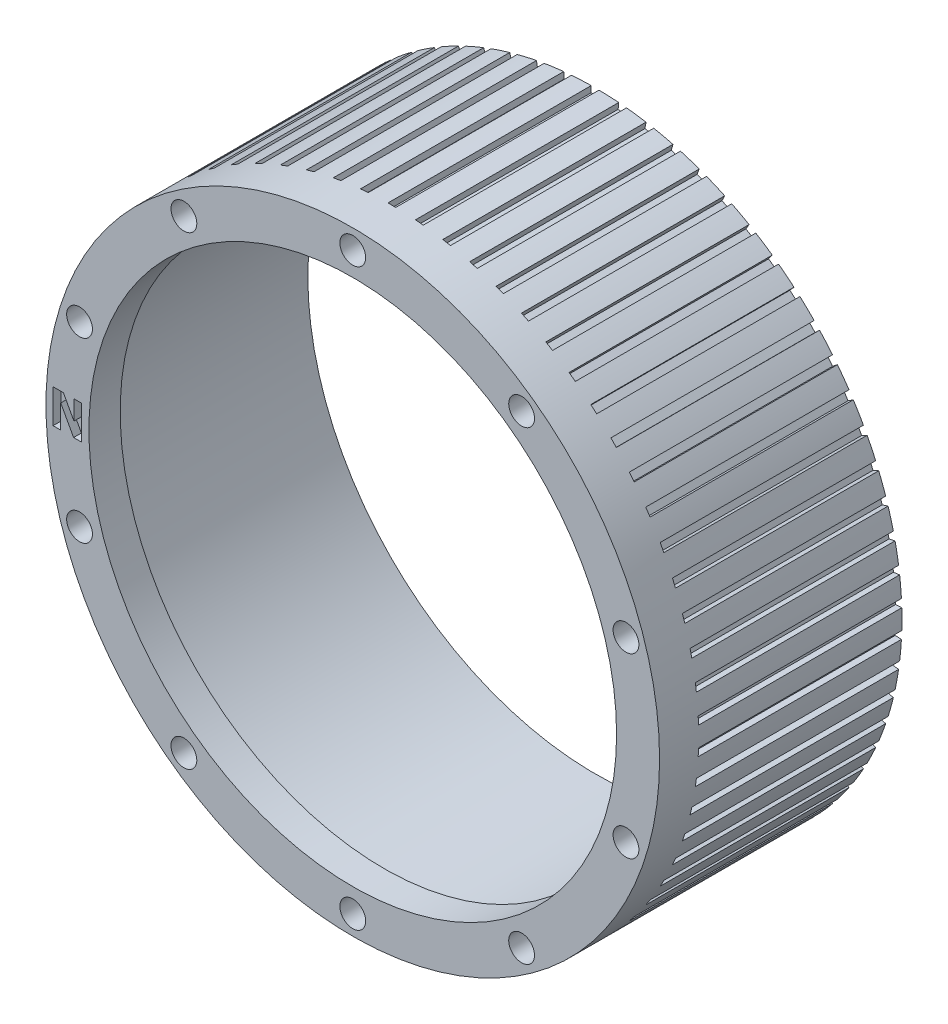
from build123d import *

# Parameters (mm, degrees)
SKETCH1_R           = 39.25
BOSS_EXTRUDE1_DEPTH = 31
SKETCH2_R           = 36.75
CUT_EXTRUDE1_DEPTH  = 27
SKETCH3_R           = 33.75
CUT_EXTRUDE2_DEPTH  = 4
SKETCH4_R           = 1.65
CUT_EXTRUDE3_DEPTH  = 2.5
SKETCH5_W           = 1
SKETCH5_H           = 0.8
CUT_EXTRUDE4_DEPTH  = 26
CUT_EXTRUDE5_DEPTH  = 1


with BuildPart() as part:
    # Sketch1 → Boss-Extrude1 (new body)
    with BuildSketch(Plane.XY):
        Circle(SKETCH1_R)
    extrude(amount=BOSS_EXTRUDE1_DEPTH)

    # Sketch2 → Cut-Extrude1 (cut)
    with BuildSketch(Plane(origin=(0, 0, 0), x_dir=(-1, 0, 0), z_dir=(0, 0, -1))):
        Circle(SKETCH2_R)
    extrude(amount=-CUT_EXTRUDE1_DEPTH, mode=Mode.SUBTRACT)

    # Sketch3 → Cut-Extrude2 (cut)
    with BuildSketch(Plane.XY.offset(31)):
        Circle(SKETCH3_R)
    extrude(amount=-CUT_EXTRUDE2_DEPTH, mode=Mode.SUBTRACT)

    # Sketch4 → Cut-Extrude3 (cut)
    with BuildSketch(Plane.XY.offset(31)):
        with Locations((-34.951326974, -11.356374543)):
            Circle(SKETCH4_R)
        with Locations((-34.951326974, 11.356374543)):
            Circle(SKETCH4_R)
        with Locations((-21.601108022, 29.731374543)):
            Circle(SKETCH4_R)
        with Locations((0, 36.75)):
            Circle(SKETCH4_R)
        with Locations((21.601108022, 29.731374543)):
            Circle(SKETCH4_R)
        with Locations((34.951326974, 11.356374543)):
            Circle(SKETCH4_R)
        with Locations((34.951326974, -11.356374543)):
            Circle(SKETCH4_R)
        with Locations((21.601108022, -29.731374543)):
            Circle(SKETCH4_R)
        with Locations((0, -36.75)):
            Circle(SKETCH4_R)
        with Locations((-21.601108022, -29.731374543)):
            Circle(SKETCH4_R)
    extrude(amount=-CUT_EXTRUDE3_DEPTH, mode=Mode.SUBTRACT)

    # Sketch5 → Cut-Extrude4 (cut)
    with BuildSketch(Plane(origin=(0, 0, 0), x_dir=(-1, 0, 0), z_dir=(0, 0, -1))):
        with Locations((0, 38.85)):
            Rectangle(SKETCH5_W, SKETCH5_H)
        Polygon((3.020355727, 39.136810694), (2.94864428, 38.340031259), (3.944618574, 38.25039195), (4.016330021, 39.047171385), align=None)
        Polygon((6.516393327, 38.7085148), (6.373547811, 37.921371129), (7.357477399, 37.742814234), (7.500322915, 38.529957905), align=None)
        Polygon((9.959964758, 37.968560705), (9.747135282, 37.197390417), (10.711098142, 36.931353571), (10.923927619, 37.70252386), align=None)
        Polygon((13.32334441, 36.922906085), (13.042244551, 36.173918188), (13.978479421, 35.822543364), (14.259579281, 36.571531261), align=None)
        Polygon((16.579452326, 35.579969935), (16.232345335, 34.85919484), (17.133314203, 34.425311101), (17.480421194, 35.146086196), align=None)
        Polygon((19.702072241, 33.950564788), (19.291752819, 33.263805753), (20.150201613, 32.750906475), (20.560521035, 33.43766551), align=None)
        Polygon((22.666062655, 32.047809655), (22.195834453, 31.40059606), (23.004851448, 30.812810808), (23.47507965, 31.460024403), align=None)
        Polygon((25.44755926, 29.887024404), (24.921208279, 29.284567231), (25.674279745, 28.626628505), (26.200630726, 29.229085678), align=None)
        Polygon((28.024167081, 27.485606405), (27.44593119, 26.932756285), (28.136993839, 26.209961422), (28.71522973, 26.762811541), align=None)
        Polygon((30.375140786, 24.862890464), (29.7496756, 24.364098623), (30.373165402, 23.58226714), (30.998630588, 24.081058982), align=None)
        Polygon((32.481551718, 22.039993149), (31.813893115, 21.599275564), (32.364790096, 20.76470231), (33.032448699, 21.205419895), align=None)
        Polygon((34.326440294, 19.039642768), (33.621963869, 18.660547838), (34.095832531, 17.779952306), (34.800308957, 18.159047236), align=None)
        Polygon((35.894952557, 15.885996379), (35.159330339, 15.571576353), (35.55235537, 14.652048581), (36.287977588, 14.966468606), align=None)
        Polygon((37.174459767, 12.604445287), (36.413614554, 12.357231692), (36.722631549, 11.406175176), (37.483476762, 11.653388771), align=None)
        Polygon((38.154660086, 9.221410614), (37.374717756, 9.043393867), (37.59723869, 8.068465955), (38.37718102, 8.246482702), align=None)
        Polygon((38.827661516, 5.764130564), (38.034901707, 5.656743952), (38.169134973, 4.66579419), (38.961894782, 4.773180802), align=None)
        Polygon((39.188045447, 2.260441125), (38.388850993, 2.22454926), (38.433715824, 1.225556194), (39.232910277, 1.261448058), align=None)
        Polygon((39.232910277, -1.261448058), (38.433715824, -1.225556194), (38.388850993, -2.22454926), (39.188045447, -2.260441125), align=None)
        Polygon((38.961894782, -4.773180802), (38.169134973, -4.66579419), (38.034901707, -5.656743952), (38.827661516, -5.764130564), align=None)
        Polygon((38.37718102, -8.246482702), (37.59723869, -8.068465955), (37.374717756, -9.043393867), (38.154660086, -9.221410614), align=None)
        Polygon((37.483476762, -11.653388771), (36.722631549, -11.406175176), (36.413614554, -12.357231692), (37.174459767, -12.604445287), align=None)
        Polygon((36.287977588, -14.966468606), (35.55235537, -14.652048581), (35.159330339, -15.571576353), (35.894952557, -15.885996379), align=None)
        Polygon((34.800308957, -18.159047236), (34.095832531, -17.779952306), (33.621963869, -18.660547838), (34.326440294, -19.039642768), align=None)
        Polygon((33.032448699, -21.205419895), (32.364790096, -20.76470231), (31.813893115, -21.599275564), (32.481551718, -22.039993149), align=None)
        Polygon((30.998630588, -24.081058982), (30.373165402, -23.58226714), (29.7496756, -24.364098623), (30.375140786, -24.862890464), align=None)
        Polygon((28.71522973, -26.762811541), (28.136993839, -26.209961422), (27.44593119, -26.932756285), (28.024167081, -27.485606405), align=None)
        Polygon((26.200630726, -29.229085678), (25.674279745, -28.626628505), (24.921208279, -29.284567231), (25.44755926, -29.887024404), align=None)
        Polygon((23.47507965, -31.460024403), (23.004851448, -30.812810808), (22.195834453, -31.40059606), (22.666062655, -32.047809655), align=None)
        Polygon((20.560521035, -33.43766551), (20.150201613, -32.750906475), (19.291752819, -33.263805753), (19.702072241, -33.950564788), align=None)
        Polygon((17.480421194, -35.146086196), (17.133314203, -34.425311101), (16.232345335, -34.85919484), (16.579452326, -35.579969935), align=None)
        Polygon((14.259579281, -36.571531261), (13.978479421, -35.822543364), (13.042244551, -36.173918188), (13.32334441, -36.922906085), align=None)
        Polygon((10.923927619, -37.70252386), (10.711098142, -36.931353571), (9.747135282, -37.197390417), (9.959964758, -37.968560705), align=None)
        Polygon((7.500322915, -38.529957905), (7.357477399, -37.742814234), (6.373547811, -37.921371129), (6.516393327, -38.7085148), align=None)
        Polygon((4.016330021, -39.047171385), (3.944618574, -38.25039195), (2.94864428, -38.340031259), (3.020355727, -39.136810694), align=None)
        with Locations((0, -38.85)):
            Rectangle(SKETCH5_W, SKETCH5_H)
        Polygon((-3.020355727, -39.136810694), (-2.94864428, -38.340031259), (-3.944618574, -38.25039195), (-4.016330021, -39.047171385), align=None)
        Polygon((-6.516393327, -38.7085148), (-6.373547811, -37.921371129), (-7.357477399, -37.742814234), (-7.500322915, -38.529957905), align=None)
        Polygon((-9.959964758, -37.968560705), (-9.747135282, -37.197390417), (-10.711098142, -36.931353571), (-10.923927619, -37.70252386), align=None)
        Polygon((-13.32334441, -36.922906085), (-13.042244551, -36.173918188), (-13.978479421, -35.822543364), (-14.259579281, -36.571531261), align=None)
        Polygon((-16.579452326, -35.579969935), (-16.232345335, -34.85919484), (-17.133314203, -34.425311101), (-17.480421194, -35.146086196), align=None)
        Polygon((-19.702072241, -33.950564788), (-19.291752819, -33.263805753), (-20.150201613, -32.750906475), (-20.560521035, -33.43766551), align=None)
        Polygon((-22.666062655, -32.047809655), (-22.195834453, -31.40059606), (-23.004851448, -30.812810808), (-23.47507965, -31.460024403), align=None)
        Polygon((-25.44755926, -29.887024404), (-24.921208279, -29.284567231), (-25.674279745, -28.626628505), (-26.200630726, -29.229085678), align=None)
        Polygon((-28.024167081, -27.485606405), (-27.44593119, -26.932756285), (-28.136993839, -26.209961422), (-28.71522973, -26.762811541), align=None)
        Polygon((-30.375140786, -24.862890464), (-29.7496756, -24.364098623), (-30.373165402, -23.58226714), (-30.998630588, -24.081058982), align=None)
        Polygon((-32.481551718, -22.039993149), (-31.813893115, -21.599275564), (-32.364790096, -20.76470231), (-33.032448699, -21.205419895), align=None)
        Polygon((-34.326440294, -19.039642768), (-33.621963869, -18.660547838), (-34.095832531, -17.779952306), (-34.800308957, -18.159047236), align=None)
        Polygon((-35.894952557, -15.885996379), (-35.159330339, -15.571576353), (-35.55235537, -14.652048581), (-36.287977588, -14.966468606), align=None)
        Polygon((-37.174459767, -12.604445287), (-36.413614554, -12.357231692), (-36.722631549, -11.406175176), (-37.483476762, -11.653388771), align=None)
        Polygon((-38.154660086, -9.221410614), (-37.374717756, -9.043393867), (-37.59723869, -8.068465955), (-38.37718102, -8.246482702), align=None)
        Polygon((-38.827661516, -5.764130564), (-38.034901707, -5.656743952), (-38.169134973, -4.66579419), (-38.961894782, -4.773180802), align=None)
        Polygon((-39.188045447, -2.260441125), (-38.388850993, -2.22454926), (-38.433715824, -1.225556194), (-39.232910277, -1.261448058), align=None)
        Polygon((-39.232910277, 1.261448058), (-38.433715824, 1.225556194), (-38.388850993, 2.22454926), (-39.188045447, 2.260441125), align=None)
        Polygon((-38.961894782, 4.773180802), (-38.169134973, 4.66579419), (-38.034901707, 5.656743952), (-38.827661516, 5.764130564), align=None)
        Polygon((-38.37718102, 8.246482702), (-37.59723869, 8.068465955), (-37.374717756, 9.043393867), (-38.154660086, 9.221410614), align=None)
        Polygon((-37.483476762, 11.653388771), (-36.722631549, 11.406175176), (-36.413614554, 12.357231692), (-37.174459767, 12.604445287), align=None)
        Polygon((-36.287977588, 14.966468606), (-35.55235537, 14.652048581), (-35.159330339, 15.571576353), (-35.894952557, 15.885996379), align=None)
        Polygon((-34.800308957, 18.159047236), (-34.095832531, 17.779952306), (-33.621963869, 18.660547838), (-34.326440294, 19.039642768), align=None)
        Polygon((-33.032448699, 21.205419895), (-32.364790096, 20.76470231), (-31.813893115, 21.599275564), (-32.481551718, 22.039993149), align=None)
        Polygon((-30.998630588, 24.081058982), (-30.373165402, 23.58226714), (-29.7496756, 24.364098623), (-30.375140786, 24.862890464), align=None)
        Polygon((-28.71522973, 26.762811541), (-28.136993839, 26.209961422), (-27.44593119, 26.932756285), (-28.024167081, 27.485606405), align=None)
        Polygon((-26.200630726, 29.229085678), (-25.674279745, 28.626628505), (-24.921208279, 29.284567231), (-25.44755926, 29.887024404), align=None)
        Polygon((-23.47507965, 31.460024403), (-23.004851448, 30.812810808), (-22.195834453, 31.40059606), (-22.666062655, 32.047809655), align=None)
        Polygon((-20.560521035, 33.43766551), (-20.150201613, 32.750906475), (-19.291752819, 33.263805753), (-19.702072241, 33.950564788), align=None)
        Polygon((-17.480421194, 35.146086196), (-17.133314203, 34.425311101), (-16.232345335, 34.85919484), (-16.579452326, 35.579969935), align=None)
        Polygon((-14.259579281, 36.571531261), (-13.978479421, 35.822543364), (-13.042244551, 36.173918188), (-13.32334441, 36.922906085), align=None)
        Polygon((-10.923927619, 37.70252386), (-10.711098142, 36.931353571), (-9.747135282, 37.197390417), (-9.959964758, 37.968560705), align=None)
        Polygon((-7.500322915, 38.529957905), (-7.357477399, 37.742814234), (-6.373547811, 37.921371129), (-6.516393327, 38.7085148), align=None)
        Polygon((-4.016330021, 39.047171385), (-3.944618574, 38.25039195), (-2.94864428, 38.340031259), (-3.020355727, 39.136810694), align=None)
    extrude(amount=-CUT_EXTRUDE4_DEPTH, mode=Mode.SUBTRACT)

    # Sketch6 → Cut-Extrude5 (cut)
    with BuildSketch(Plane.XY.offset(31)):
        Polygon((-34.678341082, -1.84903576), (-35.712955587, -1.84903576), (-37.355363431, 1.160053457), (-37.355363431, -1.84903576), (-38.338759397, -1.84903576), (-38.338759397, 2.466979865), (-37.020735638, 2.466979865), (-35.661737047, -0.005168325), (-35.661737047, 2.466979865), (-34.678341082, 2.466979865), align=None)
    extrude(amount=-CUT_EXTRUDE5_DEPTH, mode=Mode.SUBTRACT)


solid = part.part
